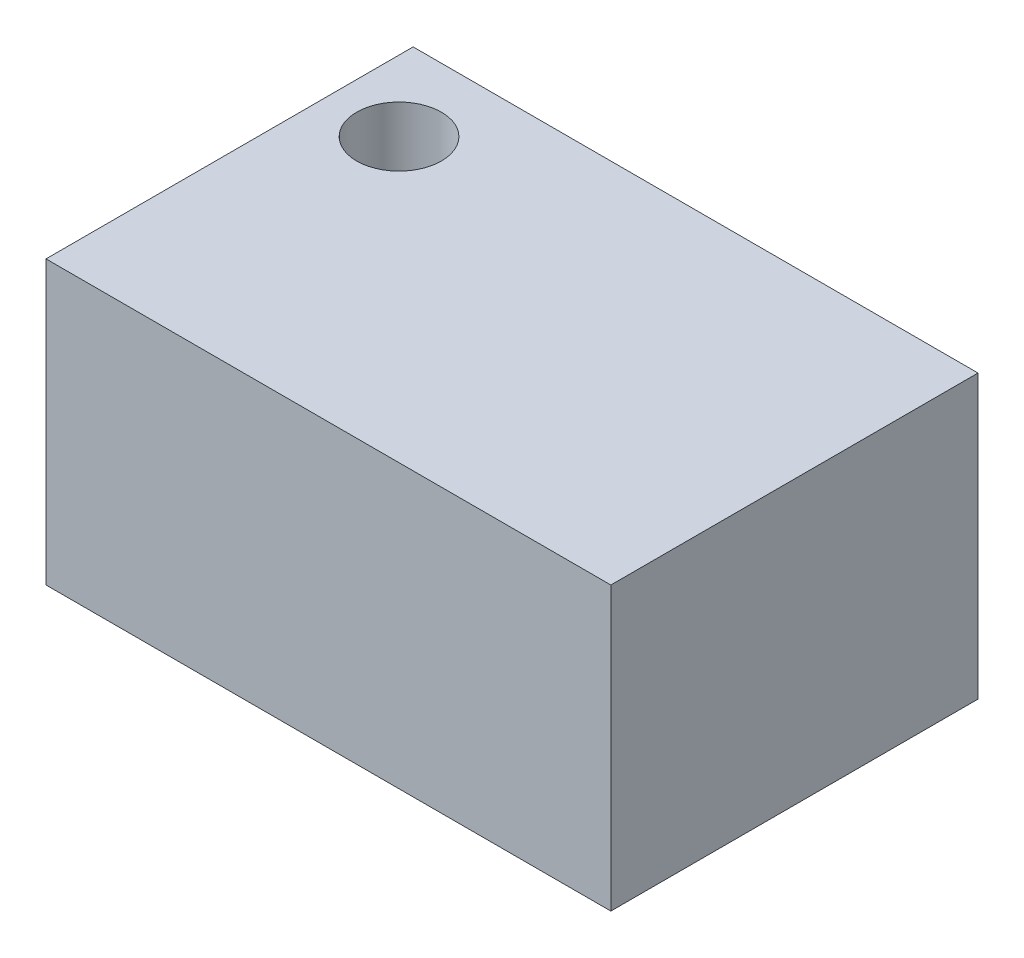
from build123d import *

# Parameters (mm, degrees)
ESQUISSE1_W        = 20
ESQUISSE1_H        = 13
ESQUISSE1_R        = 1.5
BOSS_EXTRU_1_DEPTH = 10


with BuildPart() as part:
    # Esquisse1 → Boss.-Extru.1 (new body)
    with BuildSketch(Plane(origin=(0, 0, 0), x_dir=(1, 0, 0), z_dir=(0, 1, 0))):
        Rectangle(ESQUISSE1_W, ESQUISSE1_H)
        with Locations(Location((-7.5, 3.5, 0), (0, 0, 270))):
            Circle(ESQUISSE1_R, mode=Mode.SUBTRACT)
    extrude(amount=BOSS_EXTRU_1_DEPTH)


solid = part.part
